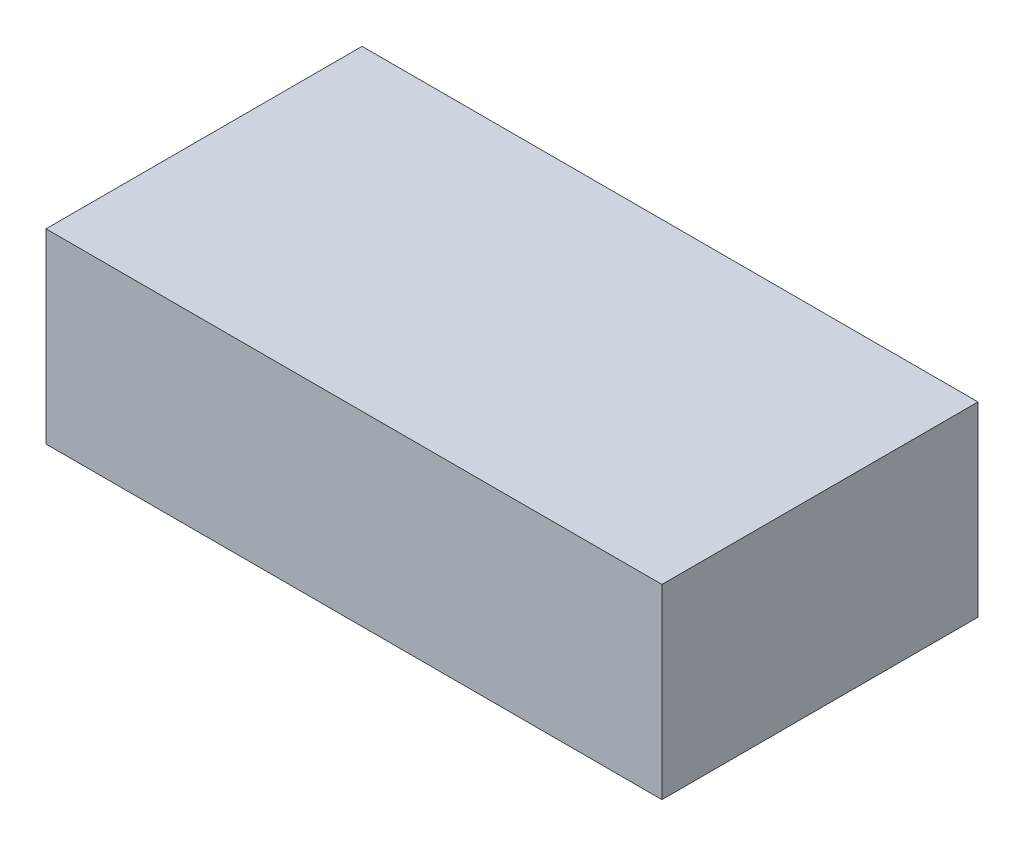
from build123d import *

# Parameters (mm, degrees)
SKETCH1_W           = 76
SKETCH1_H           = 39
BOSS_EXTRUDE1_DEPTH = 23


with BuildPart() as part:
    # Sketch1 → Boss-Extrude1 (new body)
    with BuildSketch(Plane(origin=(0, 0, 0), x_dir=(1, 0, 0), z_dir=(0, 1, 0))):
        with Locations((38, -19.5)):
            Rectangle(SKETCH1_W, SKETCH1_H)
    extrude(amount=BOSS_EXTRUDE1_DEPTH)


solid = part.part
